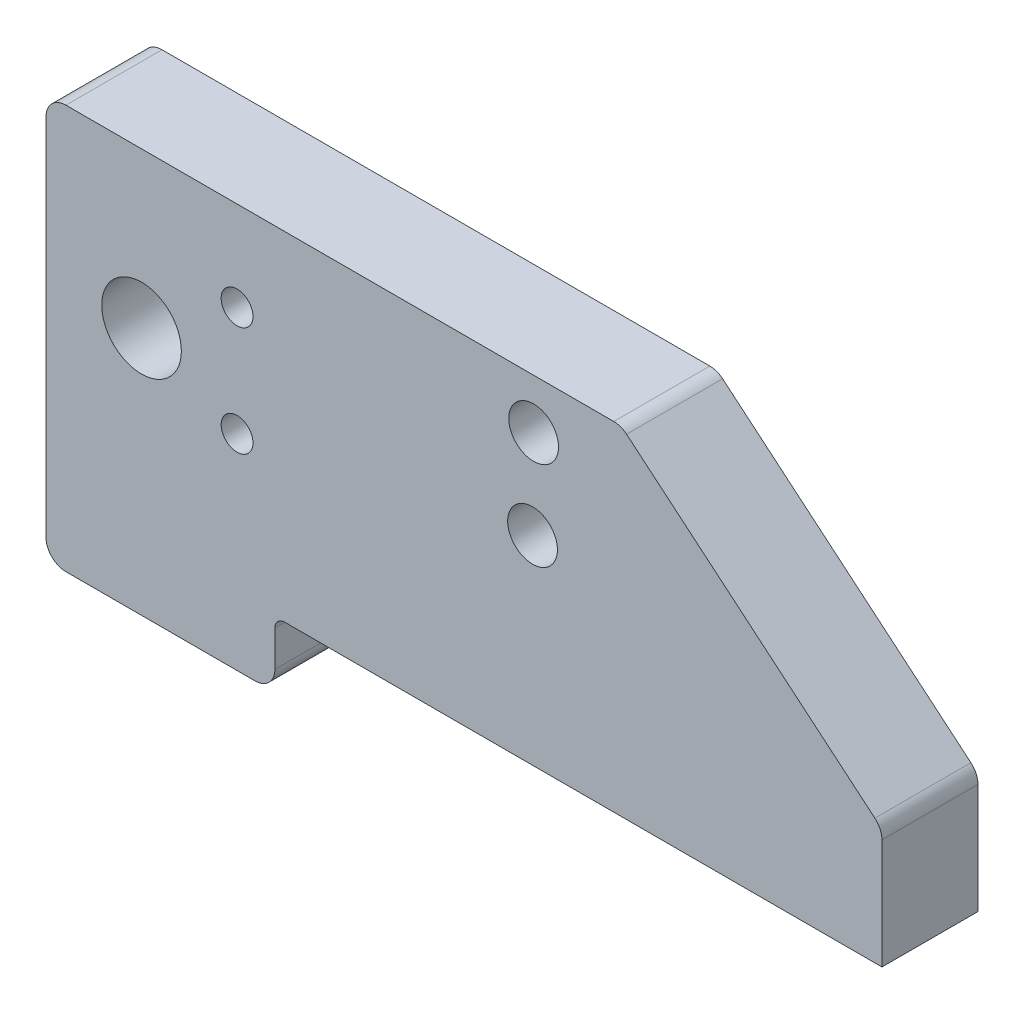
from build123d import *

# Parameters (mm, degrees)
BOSS_EXTRUDE1_DEPTH             = 4.826
M3X0_5_TAPPED_HOLE1_D           = 2.5
TAP_DRILL_FOR_M3X0_5_TAP1_D     = 2.5
TAP_DRILL_FOR_M3X0_5_TAP1_DEPTH = 5
TAP_DRILL_FOR_M3X0_5_TAP1_TIP   = 0.751075774
SKETCH1_3_R                     = 2
BOSS_EXTRUDE2_DEPTH             = 4.826
M3X0_5_TAPPED_HOLE2_D           = 2.5
FILLET1_R                       = 1
M2_TAPPED_HOLES_D               = 1.6
FILLET2_R                       = 0.5


with BuildPart() as part:
    # Sketch1 → Boss-Extrude1 (new body)
    with BuildSketch(Plane.XY):
        Polygon((13.109289519, 0), (0, 0), (-8.890710481, 0), (-8.890710481, 17), (0, 17), (13.109289519, 6), align=None)
    extrude(amount=BOSS_EXTRUDE1_DEPTH)

    # M3x0.5 Tapped Hole1 (through all)
    with Locations(Plane.XY.offset(4.826)):
        with Locations((-4.445355241, 10)):
            Hole(M3X0_5_TAPPED_HOLE1_D / 2)

    # Tap Drill for M3x0.5 Tap1
    with Locations(Plane(origin=(-1.890710481, 0, 2.413), x_dir=(0, 0, -1), z_dir=(0, -1, 0))):
        with Locations((0, 0), (0, 12)):
            Hole(TAP_DRILL_FOR_M3X0_5_TAP1_D / 2, depth=TAP_DRILL_FOR_M3X0_5_TAP1_DEPTH)
            with Locations((0, 0, -(TAP_DRILL_FOR_M3X0_5_TAP1_DEPTH + TAP_DRILL_FOR_M3X0_5_TAP1_TIP / 2))):  # 118° drill point
                Cone(0, TAP_DRILL_FOR_M3X0_5_TAP1_D / 2, TAP_DRILL_FOR_M3X0_5_TAP1_TIP, mode=Mode.SUBTRACT)

    # Sketch1<3> → Boss-Extrude2 (add)
    with BuildSketch(Plane.XY):
        Polygon((-17.390710481, 0), (-8.890710481, 0), (-8.890710481, 17), (-17.390710481, 17), (-28.890710481, 17), (-28.890710481, -3.3), (-17.390710481, -3.3), align=None)
        with Locations((-24.090710481, 9.2)):
            Circle(SKETCH1_3_R, mode=Mode.SUBTRACT)
    extrude(amount=BOSS_EXTRUDE2_DEPTH)

    # M3x0.5 Tapped Hole2 (through all)
    with Locations(Plane.XY.offset(4.826)):
        with Locations((-4.390710481, 14.5)):
            Hole(M3X0_5_TAPPED_HOLE2_D / 2)

    # Fillet1
    fillet1_edges = [part.edges().sort_by_distance(p)[0] for p in [
        (0, 17, 2.413),
        (13.109289519, 6, 2.413),
        (-28.890710481, 17, 2.413),
        (-28.890710481, -3.3, 2.413),
        (-17.390710481, -3.3, 2.413),
    ]]
    fillet(fillet1_edges, radius=FILLET1_R)

    # M2 Tapped Holes (through all)
    with Locations(Plane.XY.offset(4.826)):
        with Locations((-19.290710481, 12.5), (-19.290710481, 7)):
            Hole(M2_TAPPED_HOLES_D / 2)

    # Fillet2
    fillet2_edges = [part.edges().sort_by_distance(p)[0] for p in [
        (-17.390710481, 0, 2.413),
    ]]
    fillet(fillet2_edges, radius=FILLET2_R)


solid = part.part
